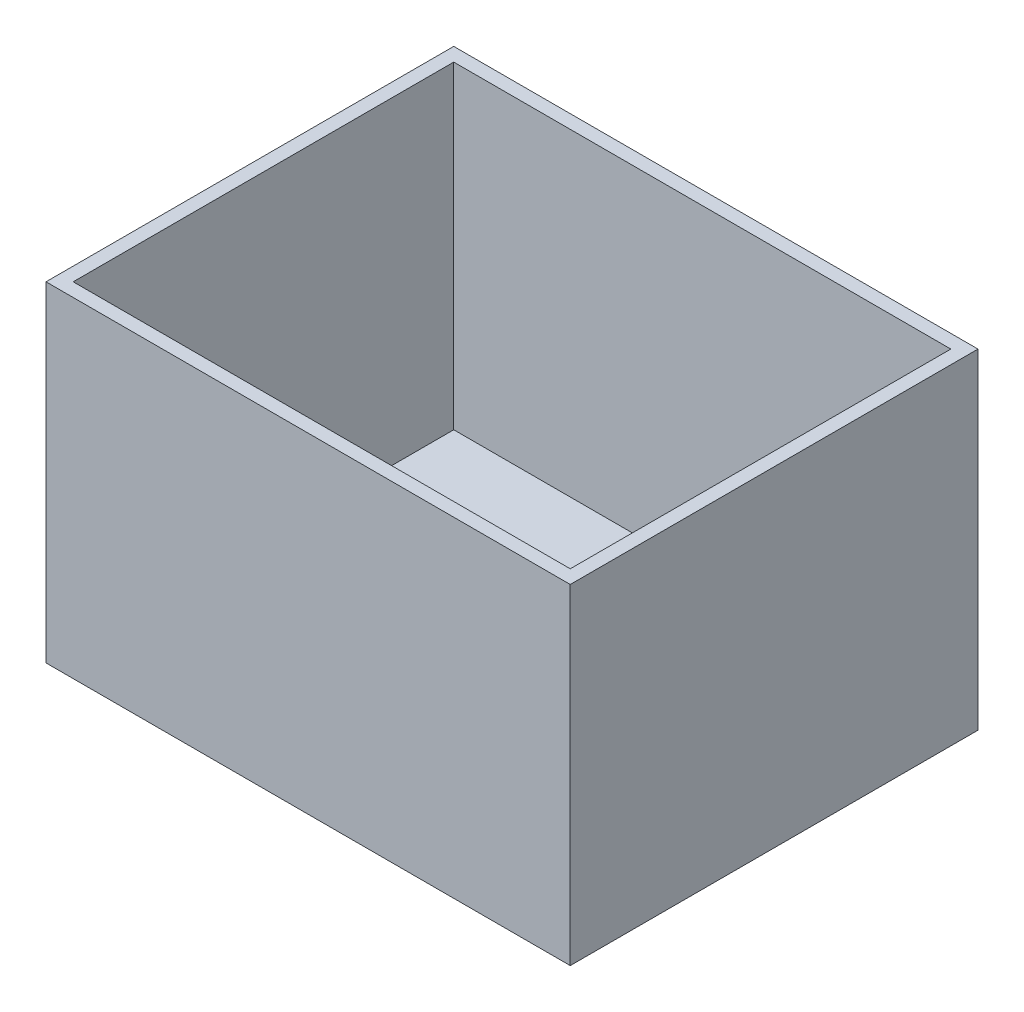
from build123d import *

# Parameters (mm, degrees)
SKETCH1_W         = 270
SKETCH1_H         = 210
SKETCH1_W_2       = 256
SKETCH1_H_2       = 196
COVER_WALLS_DEPTH = 170
SKETCH2_W         = 270
SKETCH2_H         = 210
COVER_ROOF_DEPTH  = 6


with BuildPart() as part:
    # Sketch1 → Cover_Walls (new body)
    with BuildSketch(Plane(origin=(0, 0, 0), x_dir=(1, 0, 0), z_dir=(0, 1, 0))):
        Rectangle(SKETCH1_W, SKETCH1_H)
        Rectangle(SKETCH1_W_2, SKETCH1_H_2, mode=Mode.SUBTRACT)
    extrude(amount=COVER_WALLS_DEPTH)

    # Sketch2 → Cover_Roof (add)
    with BuildSketch(Plane(origin=(0, 0, 0), x_dir=(1, 0, 0), z_dir=(0, 1, 0))):
        Rectangle(SKETCH2_W, SKETCH2_H)
    extrude(amount=COVER_ROOF_DEPTH)


solid = part.part
